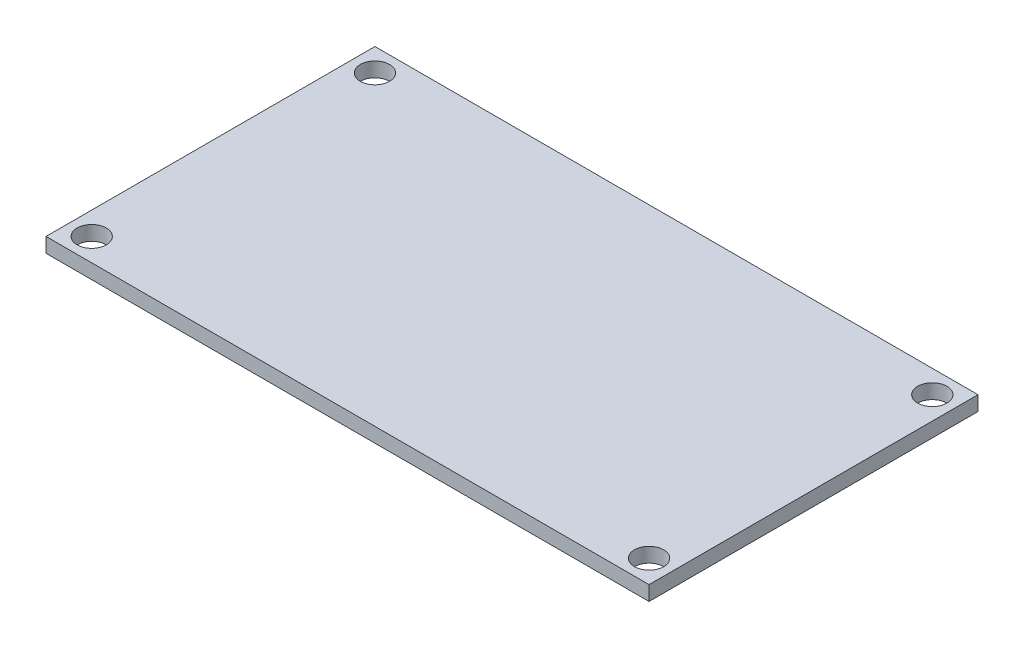
from build123d import *

# Parameters (mm, degrees)
BASES_W              = 66
BASES_H              = 36
BASE_DEPTH           = 1.6
M3_CLEARANCE_HOLE1_D = 3.2
MIRROR2_COPY_1_D     = 3.2


with BuildPart() as part:
    # BaseS → Base (new body)
    with BuildSketch(Plane(origin=(0, 0, 0), x_dir=(1, 0, 0), z_dir=(0, 1, 0))):
        Rectangle(BASES_W, BASES_H)
    extrude(amount=BASE_DEPTH)

    # M3 Clearance Hole1 (through all)
    with Locations(Plane(origin=(0, 1.6, 0), x_dir=(1, 0, 0), z_dir=(0, 1, 0))):
        with Locations((-30.5, 15.5)):
            m3_clearance_hole1 = Hole(M3_CLEARANCE_HOLE1_D / 2)

    # Mirror1: M3 Clearance Hole1 across plane
    add(m3_clearance_hole1.mirror(Plane(origin=(0, 0, 0), x_dir=(0, 0, 1), z_dir=(1, 0, 0))), mode=Mode.SUBTRACT)

    # Mirror2: M3 Clearance Hole1 across plane
    add(m3_clearance_hole1.mirror(Plane.XY), mode=Mode.SUBTRACT)

    # Mirror2 copy 1 (through all)
    with Locations(Plane(origin=(0, 1.6, 0), x_dir=(-1, 0, 0), z_dir=(0, 1, 0))):
        with Locations((-30.5, 15.5)):
            Hole(MIRROR2_COPY_1_D / 2)


solid = part.part
